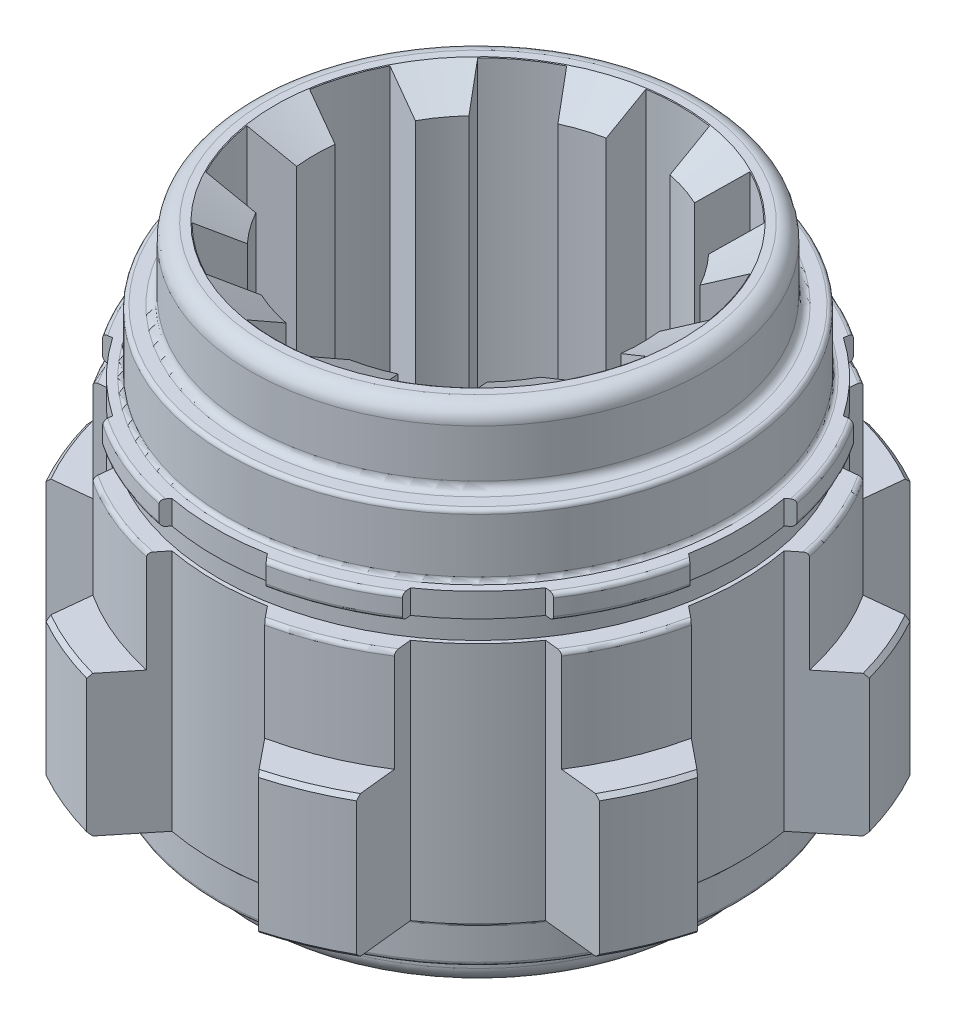
from build123d import *

# Parameters (mm, degrees)
FILETE1_R             = 2
FILETE2_R             = 1
FILETE3_R             = 0.5
CHANFRO1_SIZE         = 0.5
CHANFRO2_SIZE         = 5
CHANFRO2_SIZE2        = 2.886751346
CHANFRO3_SIZE         = 5
CHANFRO3_SIZE2        = 2.886751346
FILETE4_R             = 2
FILETE5_R             = 0.5
CORTE_EXTRUS_O1_DEPTH = 85.528368019
CORTE_EXTRUS_O2_DEPTH = 84.140255911


with BuildPart() as part:
    # Esboço1 → Revolução1 (revolve)
    with BuildSketch(Plane.XY, mode=Mode.PRIVATE) as revolu_o1_sk:
        Polygon((20.5, 50.818468468), (28.5, 50.818468468), (28.5, 41.818468468), (31.5, 41.818468468), (31.5, 34.018468468), (34, 34.018468468), (34, 31.018468468), (32.5, 31.018468468), (32.5, 28.318468468), (35, 28.318468468), (35, 15.518468468), (39.85, 15.518468468), (39.85, -2.181531532), (32.5, -2.181531532), (32.5, -7.181531532), (28.5, -7.181531532), (28.5, -12.181531532), (20.5, -12.181531532), align=None)
    revolve(revolu_o1_sk.sketch.rotate(Axis((0, -54.461261261, 0), (0, 1, 0)), 90), axis=Axis((0, -54.461261261, 0), (0, 1, 0)))

    # Filete1
    filete1_edges = [part.edges().sort_by_distance(p)[0] for p in [
        (0, 50.818468468, 28.5),
    ]]
    fillet(filete1_edges, radius=FILETE1_R)

    # Filete2
    filete2_edges = [part.edges().sort_by_distance(p)[0] for p in [
        (0, 41.818468468, 28.5),
    ]]
    fillet(filete2_edges, radius=FILETE2_R)

    # Filete3
    filete3_edges = [part.edges().sort_by_distance(p)[0] for p in [
        (0, 28.318468468, 35),
        (0, 31.018468468, 34),
        (0, 34.018468468, 34),
        (0, 34.018468468, 31.5),
        (0, 41.818468468, 31.5),
    ]]
    fillet(filete3_edges, radius=FILETE3_R)

    # Chanfro1
    chanfro1_edges = [part.edges().sort_by_distance(p)[0] for p in [
        (0, -2.181531532, 39.85),
        (0, 15.518468468, 39.85),
    ]]
    chamfer(chanfro1_edges, length=CHANFRO1_SIZE)

    # Chanfro2
    chanfro2_edges = [part.edges().sort_by_distance(p)[0] for p in [
        (0, 50.818468468, 20.5),
    ]]
    chanfro2_side = [part.faces().sort_by_distance(p)[0] for p in [
        (0, 50.818468468, 25.750466812),
    ]]
    chamfer(chanfro2_edges, length=CHANFRO2_SIZE, length2=CHANFRO2_SIZE2, reference=chanfro2_side[0])

    # Chanfro3
    chanfro3_edges = [part.edges().sort_by_distance(p)[0] for p in [
        (0, -12.181531532, 20.5),
    ]]
    chanfro3_side = [part.faces().sort_by_distance(p)[0] for p in [
        (0, -12.181531532, 27.693898269),
    ]]
    chamfer(chanfro3_edges, length=CHANFRO3_SIZE, length2=CHANFRO3_SIZE2, reference=chanfro3_side[0])

    # Filete4
    filete4_edges = [part.edges().sort_by_distance(p)[0] for p in [
        (0, -12.181531532, 28.5),
    ]]
    fillet(filete4_edges, radius=FILETE4_R)

    # Filete5
    filete5_edges = [part.edges().sort_by_distance(p)[0] for p in [
        (0, -7.181531532, 28.5),
        (0, -7.181531532, 32.5),
        (0, -2.181531532, 32.5),
    ]]
    fillet(filete5_edges, radius=FILETE5_R)

    # Esboço2 → Corte-extrusão1 (cut, through all)
    with BuildSketch(Plane.XZ.offset(12.181531532)):
        with BuildLine():
            ThreePointArc((6, -32.449961479), (0, -33), (-6, -32.449961479))
            Line((-6, -32.449961479), (-13.697117838, -41.95511041))
            Line((-13.697117838, -41.95511041), (13.697117838, -41.95511041))
            Line((13.697117838, -41.95511041), (6, -32.449961479))
        make_face()
        with BuildLine():
            ThreePointArc((-18.702947124, -27.188228498), (-23.334523779, -23.334523779), (-27.188228498, -18.702947124))
            Line((-27.188228498, -18.702947124), (-39.352067982, -19.981418171))
            Line((-39.352067982, -19.981418171), (-19.981418171, -39.352067982))
            Line((-19.981418171, -39.352067982), (-18.702947124, -27.188228498))
        make_face()
        with BuildLine():
            ThreePointArc((-32.449961479, -6), (-33, 0), (-32.449961479, 6))
            Line((-32.449961479, 6), (-41.95511041, 13.697117838))
            Line((-41.95511041, 13.697117838), (-41.95511041, -13.697117838))
            Line((-41.95511041, -13.697117838), (-32.449961479, -6))
        make_face()
        with BuildLine():
            ThreePointArc((-27.188228498, 18.702947124), (-23.334523779, 23.334523779), (-18.702947124, 27.188228498))
            Line((-18.702947124, 27.188228498), (-19.981418171, 39.352067982))
            Line((-19.981418171, 39.352067982), (-39.352067982, 19.981418171))
            Line((-39.352067982, 19.981418171), (-27.188228498, 18.702947124))
        make_face()
        with BuildLine():
            ThreePointArc((-6, 32.449961479), (0, 33), (6, 32.449961479))
            Line((6, 32.449961479), (13.697117838, 41.95511041))
            Line((13.697117838, 41.95511041), (-13.697117838, 41.95511041))
            Line((-13.697117838, 41.95511041), (-6, 32.449961479))
        make_face()
        with BuildLine():
            ThreePointArc((18.702947124, 27.188228498), (23.334523779, 23.334523779), (27.188228498, 18.702947124))
            Line((27.188228498, 18.702947124), (39.352067982, 19.981418171))
            Line((39.352067982, 19.981418171), (19.981418171, 39.352067982))
            Line((19.981418171, 39.352067982), (18.702947124, 27.188228498))
        make_face()
        with BuildLine():
            ThreePointArc((32.449961479, 6), (33, 0), (32.449961479, -6))
            Line((32.449961479, -6), (41.95511041, -13.697117838))
            Line((41.95511041, -13.697117838), (41.95511041, 13.697117838))
            Line((41.95511041, 13.697117838), (32.449961479, 6))
        make_face()
        with BuildLine():
            ThreePointArc((27.188228498, -18.702947124), (23.334523779, -23.334523779), (18.702947124, -27.188228498))
            Line((18.702947124, -27.188228498), (19.981418171, -39.352067982))
            Line((19.981418171, -39.352067982), (39.352067982, -19.981418171))
            Line((39.352067982, -19.981418171), (27.188228498, -18.702947124))
        make_face()
    extrude(amount=-CORTE_EXTRUS_O1_DEPTH, mode=Mode.SUBTRACT)

    # Esboço3 → Corte-extrusão2 (cut, through all)
    with BuildSketch(Plane(origin=(0, 50.818468468, 0), x_dir=(1, 0, 0), z_dir=(0, 1, 0))):
        with BuildLine():
            Line((-4, 25.083062014), (-4, 18.405307299))
            Line((-4, 18.405307299), (4, 18.405307299))
            Line((4, 18.405307299), (4, 25.083062014))
            ThreePointArc((4, 25.083062014), (0, 25.400000573), (-4, 25.083062014))
        make_face()
        with BuildLine():
            Line((11.507385957, 22.643764449), (7.582300217, 17.241347401))
            Line((7.582300217, 17.241347401), (14.054436172, 12.539065382))
            Line((14.054436172, 12.539065382), (17.979521912, 17.941482431))
            ThreePointArc((17.979521912, 17.941482431), (14.929745745, 20.549032121), (11.507385957, 22.643764449))
        make_face()
        with BuildLine():
            Line((22.6193416, 11.555318498), (16.268419463, 9.491778807))
            Line((16.268419463, 9.491778807), (18.740555418, 1.883326677))
            Line((18.740555418, 1.883326677), (25.091477555, 3.946866368))
            ThreePointArc((25.091477555, 3.946866368), (24.156836059, 7.849031834), (22.6193416, 11.555318498))
        make_face()
        with BuildLine():
            Line((25.091477555, -3.946866368), (18.740555418, -1.883326677))
            Line((18.740555418, -1.883326677), (16.268419463, -9.491778807))
            Line((16.268419463, -9.491778807), (22.6193416, -11.555318498))
            ThreePointArc((22.6193416, -11.555318498), (24.156836059, -7.849031834), (25.091477555, -3.946866368))
        make_face()
        with BuildLine():
            Line((17.979521912, -17.941482431), (14.054436172, -12.539065382))
            Line((14.054436172, -12.539065382), (7.582300217, -17.241347401))
            Line((7.582300217, -17.241347401), (11.507385957, -22.643764449))
            ThreePointArc((11.507385957, -22.643764449), (14.929745745, -20.549032121), (17.979521912, -17.941482431))
        make_face()
        with BuildLine():
            Line((4, -25.083062014), (4, -18.405307299))
            Line((4, -18.405307299), (-4, -18.405307299))
            Line((-4, -18.405307299), (-4, -25.083062014))
            ThreePointArc((-4, -25.083062014), (0, -25.400000573), (4, -25.083062014))
        make_face()
        with BuildLine():
            Line((-11.507385957, -22.643764449), (-7.582300217, -17.241347401))
            Line((-7.582300217, -17.241347401), (-14.054436172, -12.539065382))
            Line((-14.054436172, -12.539065382), (-17.979521912, -17.941482431))
            ThreePointArc((-17.979521912, -17.941482431), (-14.929745745, -20.549032121), (-11.507385957, -22.643764449))
        make_face()
        with BuildLine():
            Line((-22.6193416, -11.555318498), (-16.268419463, -9.491778807))
            Line((-16.268419463, -9.491778807), (-18.740555418, -1.883326677))
            Line((-18.740555418, -1.883326677), (-25.091477555, -3.946866368))
            ThreePointArc((-25.091477555, -3.946866368), (-24.156836059, -7.849031834), (-22.6193416, -11.555318498))
        make_face()
        with BuildLine():
            Line((-25.091477555, 3.946866368), (-18.740555418, 1.883326677))
            Line((-18.740555418, 1.883326677), (-16.268419463, 9.491778807))
            Line((-16.268419463, 9.491778807), (-22.6193416, 11.555318498))
            ThreePointArc((-22.6193416, 11.555318498), (-24.156836059, 7.849031834), (-25.091477555, 3.946866368))
        make_face()
        with BuildLine():
            Line((-17.979521912, 17.941482431), (-14.054436172, 12.539065382))
            Line((-14.054436172, 12.539065382), (-7.582300217, 17.241347401))
            Line((-7.582300217, 17.241347401), (-11.507385957, 22.643764449))
            ThreePointArc((-11.507385957, 22.643764449), (-14.929745745, 20.549032121), (-17.979521912, 17.941482431))
        make_face()
    extrude(amount=-CORTE_EXTRUS_O2_DEPTH, mode=Mode.SUBTRACT)


solid = part.part
